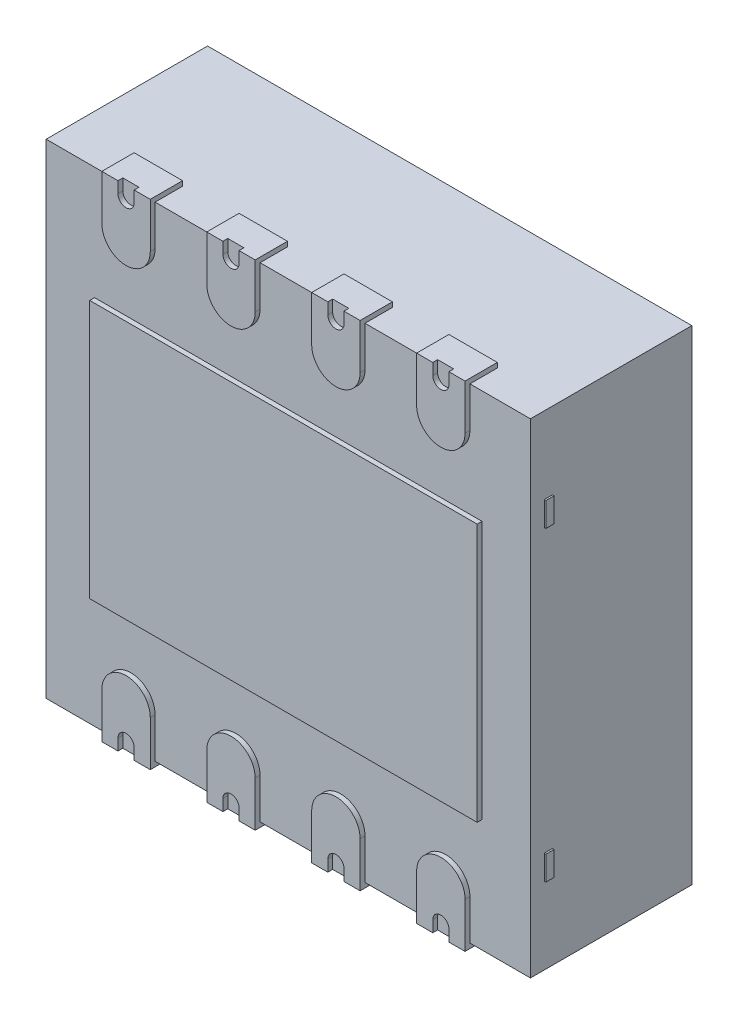
from build123d import *

# Parameters (mm, degrees)
SKETCH1_W            = 3
SKETCH1_H            = 3
BOSS_EXTRUDE1_DEPTH  = 1
SKETCH2_W            = 2.4
SKETCH2_H            = 1.6
BOSS_EXTRUDE2_DEPTH  = 0.03
SKETCH4_W            = 3.940543401
SKETCH4_H            = 3.843561114
SKETCH4_W_2          = 3
SKETCH4_H_2          = 3
CUT_EXTRUDE1_DEPTH   = 60.05
SKETCH7_W            = 0.3
SKETCH7_H            = 0.2
BOSS_EXTRUDE3_DEPTH  = 0.03
CUT_EXTRUDE2_DEPTH   = 0.03
SKETCH9_W            = 0.05
SKETCH9_H            = 0.15
BOSS_EXTRUDE4_DEPTH  = 0.01
BOSS_EXTRUDE9_DEPTH  = 0.01
BOSS_EXTRUDE10_DEPTH = 0.01


with BuildPart() as part:
    # Sketch1 → Boss-Extrude1 (new body)
    with BuildSketch(Plane.XY):
        Rectangle(SKETCH1_W, SKETCH1_H)
    extrude(amount=-BOSS_EXTRUDE1_DEPTH)

    # Sketch2 → Boss-Extrude2 (add)
    with BuildSketch(Plane(origin=(0, 0, 0), x_dir=(-1, 0, 0), z_dir=(0, 0, 1))):
        Rectangle(SKETCH2_W, SKETCH2_H)
        with BuildLine():
            Line((-1.125, 1.25), (-1.125, 1.603517793))
            ThreePointArc((-1.125, 1.603517793), (-0.975, 1.753517793), (-0.825, 1.603517793))
            Line((-0.825, 1.603517793), (-0.825, 1.25))
            ThreePointArc((-0.825, 1.25), (-0.975, 1.1), (-1.125, 1.25))
        make_face()
        with BuildLine():
            Line((-0.175, 1.25), (-0.175, 1.603517793))
            ThreePointArc((-0.175, 1.603517793), (-0.325, 1.753517793), (-0.475, 1.603517793))
            Line((-0.475, 1.603517793), (-0.475, 1.25))
            ThreePointArc((-0.475, 1.25), (-0.325, 1.1), (-0.175, 1.25))
        make_face()
        with BuildLine():
            Line((0.475, 1.25), (0.475, 1.603517793))
            ThreePointArc((0.475, 1.603517793), (0.325, 1.753517793), (0.175, 1.603517793))
            Line((0.175, 1.603517793), (0.175, 1.25))
            ThreePointArc((0.175, 1.25), (0.325, 1.1), (0.475, 1.25))
        make_face()
        with BuildLine():
            Line((1.125, 1.25), (1.125, 1.603517793))
            ThreePointArc((1.125, 1.603517793), (0.975, 1.753517793), (0.825, 1.603517793))
            Line((0.825, 1.603517793), (0.825, 1.25))
            ThreePointArc((0.825, 1.25), (0.975, 1.1), (1.125, 1.25))
        make_face()
        with BuildLine():
            Line((-1.125, -1.25), (-1.125, -1.603517793))
            ThreePointArc((-1.125, -1.603517793), (-0.975, -1.753517793), (-0.825, -1.603517793))
            Line((-0.825, -1.603517793), (-0.825, -1.25))
            ThreePointArc((-0.825, -1.25), (-0.975, -1.1), (-1.125, -1.25))
        make_face()
        with BuildLine():
            Line((-0.475, -1.25), (-0.475, -1.603517793))
            ThreePointArc((-0.475, -1.603517793), (-0.325, -1.753517793), (-0.175, -1.603517793))
            Line((-0.175, -1.603517793), (-0.175, -1.25))
            ThreePointArc((-0.175, -1.25), (-0.325, -1.1), (-0.475, -1.25))
        make_face()
        with BuildLine():
            Line((0.175, -1.25), (0.175, -1.603517793))
            ThreePointArc((0.175, -1.603517793), (0.325, -1.753517793), (0.475, -1.603517793))
            Line((0.475, -1.603517793), (0.475, -1.25))
            ThreePointArc((0.475, -1.25), (0.325, -1.1), (0.175, -1.25))
        make_face()
        with BuildLine():
            Line((0.825, -1.25), (0.825, -1.603517793))
            ThreePointArc((0.825, -1.603517793), (0.975, -1.753517793), (1.125, -1.603517793))
            Line((1.125, -1.603517793), (1.125, -1.25))
            ThreePointArc((1.125, -1.25), (0.975, -1.1), (0.825, -1.25))
        make_face()
    extrude(amount=BOSS_EXTRUDE2_DEPTH)

    # Sketch4 → Cut-Extrude1 (cut)
    with BuildSketch(Plane(origin=(0, 0, -1), x_dir=(-1, 0, 0), z_dir=(0, 0, -1))):
        with Locations((-0.076564963, -0.022969489)):
            Rectangle(SKETCH4_W, SKETCH4_H)
        Rectangle(SKETCH4_W_2, SKETCH4_H_2, mode=Mode.SUBTRACT)
    extrude(amount=-CUT_EXTRUDE1_DEPTH, mode=Mode.SUBTRACT)

    # Sketch7 → Boss-Extrude3 (add)
    with BuildSketch(Plane.XZ.offset(1.5)):
        with Locations((0.975, -0.07)):
            Rectangle(SKETCH7_W, SKETCH7_H)
        with Locations((0.325, -0.07)):
            Rectangle(SKETCH7_W, SKETCH7_H)
        with Locations((-0.325, -0.07)):
            Rectangle(SKETCH7_W, SKETCH7_H)
        with Locations((-0.975, -0.07)):
            Rectangle(SKETCH7_W, SKETCH7_H)
    boss_extrude3 = extrude(amount=BOSS_EXTRUDE3_DEPTH)

    # Mirror1: Boss-Extrude3 across plane
    add(boss_extrude3.mirror(Plane.ZX))

    # Sketch8 → Cut-Extrude2 (cut)
    with BuildSketch(Plane(origin=(0, 0, 0.03), x_dir=(-1, 0, 0), z_dir=(0, 0, 1))):
        with BuildLine():
            Line((-0.925, 1.609812611), (-0.925, 1.459812611))
            ThreePointArc((-0.925, 1.459812611), (-0.975, 1.409812611), (-1.025, 1.459812611))
            Line((-1.025, 1.459812611), (-1.025, 1.609812611))
            ThreePointArc((-1.025, 1.609812611), (-0.975, 1.659812611), (-0.925, 1.609812611))
        make_face()
        with BuildLine():
            Line((-0.375, 1.609812611), (-0.375, 1.459812611))
            ThreePointArc((-0.375, 1.459812611), (-0.325, 1.409812611), (-0.275, 1.459812611))
            Line((-0.275, 1.459812611), (-0.275, 1.609812611))
            ThreePointArc((-0.275, 1.609812611), (-0.325, 1.659812611), (-0.375, 1.609812611))
        make_face()
        with BuildLine():
            Line((0.275, 1.609812611), (0.275, 1.459812611))
            ThreePointArc((0.275, 1.459812611), (0.325, 1.409812611), (0.375, 1.459812611))
            Line((0.375, 1.459812611), (0.375, 1.609812611))
            ThreePointArc((0.375, 1.609812611), (0.325, 1.659812611), (0.275, 1.609812611))
        make_face()
        with BuildLine():
            Line((0.925, 1.609812611), (0.925, 1.459812611))
            ThreePointArc((0.925, 1.459812611), (0.975, 1.409812611), (1.025, 1.459812611))
            Line((1.025, 1.459812611), (1.025, 1.609812611))
            ThreePointArc((1.025, 1.609812611), (0.975, 1.659812611), (0.925, 1.609812611))
        make_face()
        with BuildLine():
            Line((-0.925, -1.609812611), (-0.925, -1.459812611))
            ThreePointArc((-0.925, -1.459812611), (-0.975, -1.409812611), (-1.025, -1.459812611))
            Line((-1.025, -1.459812611), (-1.025, -1.609812611))
            ThreePointArc((-1.025, -1.609812611), (-0.975, -1.659812611), (-0.925, -1.609812611))
        make_face()
        with BuildLine():
            Line((-0.275, -1.609812611), (-0.275, -1.459812611))
            ThreePointArc((-0.275, -1.459812611), (-0.325, -1.409812611), (-0.375, -1.459812611))
            Line((-0.375, -1.459812611), (-0.375, -1.609812611))
            ThreePointArc((-0.375, -1.609812611), (-0.325, -1.659812611), (-0.275, -1.609812611))
        make_face()
        with BuildLine():
            Line((0.375, -1.609812611), (0.375, -1.459812611))
            ThreePointArc((0.375, -1.459812611), (0.325, -1.409812611), (0.275, -1.459812611))
            Line((0.275, -1.459812611), (0.275, -1.609812611))
            ThreePointArc((0.275, -1.609812611), (0.325, -1.659812611), (0.375, -1.609812611))
        make_face()
        with BuildLine():
            Line((1.025, -1.609812611), (1.025, -1.459812611))
            ThreePointArc((1.025, -1.459812611), (0.975, -1.409812611), (0.925, -1.459812611))
            Line((0.925, -1.459812611), (0.925, -1.609812611))
            ThreePointArc((0.925, -1.609812611), (0.975, -1.659812611), (1.025, -1.609812611))
        make_face()
    extrude(amount=-CUT_EXTRUDE2_DEPTH, mode=Mode.SUBTRACT)

    # Sketch9 → Boss-Extrude4 (add)
    with BuildSketch(Plane.ZY.offset(1.5)):
        with Locations((-0.110800284, 0.948643646)):
            Rectangle(SKETCH9_W, SKETCH9_H)
        with Locations((-0.110800284, -0.948643646)):
            Rectangle(SKETCH9_W, SKETCH9_H)
    boss_extrude4 = extrude(amount=BOSS_EXTRUDE4_DEPTH)

    # Mirror2: Boss-Extrude4 across plane
    add(boss_extrude4.mirror(Plane(origin=(0, 0, 0), x_dir=(0, 0, 1), z_dir=(1, 0, 0))))

    # Sketch11 → Boss-Extrude9 (add)
    # profile 1 of 2: a face of its own
    with BuildSketch(Plane(origin=(0, 0, -1), x_dir=(-1, 0, 0), z_dir=(0, 0, -1))):
        with BuildLine():
            Line((-0.805854291, 1.038109942), (-0.423255467, 0.605441833))
            Line((-0.423255467, 0.605441833), (-0.423255467, 1.038109942))
            Line((-0.423255467, 1.038109942), (-0.097177649, 1.038109942))
            Line((-0.097177649, 1.038109942), (0.052640904, 0.796577554))
            Line((0.052640904, 0.796577554), (0.201820168, 1.038109942))
            Line((0.201820168, 1.038109942), (0.943650762, 1.038109942))
            ThreePointArc((0.943650762, 1.038109942), (1.045474138, 0.995933319), (1.087650762, 0.894109942))
            Line((1.087650762, 0.894109942), (1.087650762, 0.670379201))
            ThreePointArc((1.087650762, 0.670379201), (1.045474138, 0.568555824), (0.943650762, 0.526379201))
            Line((0.943650762, 0.526379201), (0.543475021, 0.526379201))
            Line((0.543475021, 0.526379201), (0.543475021, 0.206356726))
            Line((0.543475021, 0.206356726), (0.201820168, 0.206356726))
            Line((0.201820168, 0.206356726), (0.052640904, 0.446858476))
            Line((0.052640904, 0.446858476), (-0.093279754, 0.210602016))
            Line((-0.093279754, 0.210602016), (-0.396062037, 0.210602016))
            Line((-0.396062037, 0.210602016), (-0.788189355, 0.654045576))
            Line((-0.788189355, 0.654045576), (-0.788189355, 0.214790298))
            Line((-0.788189355, 0.214790298), (-1.067573051, 0.214790298))
            Line((-1.067573051, 0.214790298), (-1.067573051, 1.038109942))
            Line((-1.067573051, 1.038109942), (-0.805854291, 1.038109942))
        make_face()
        Polygon((-0.362302815, 0.999733668), (-0.118839535, 0.999733668), (0.05523679, 0.721091876), (0.222284334, 0.999733668), (0.465308002, 0.999733668), (0.23905049, 0.622327348), (0.473025575, 0.247806363), (0.231595523, 0.247806363), (0.05523679, 0.530101575), (-0.112552144, 0.250223114), (-0.362302815, 0.250223114), (-0.125560237, 0.626220348), align=None, mode=Mode.SUBTRACT)
        with BuildLine():
            Line((0.51730694, 0.999733668), (0.910767238, 0.994219094))
            ThreePointArc((0.910767238, 0.994219094), (1.011989543, 0.950619639), (1.052735051, 0.84821519))
            Line((1.052735051, 0.84821519), (1.050676437, 0.701334767))
            ThreePointArc((1.050676437, 0.701334767), (1.007797951, 0.600818431), (0.906690578, 0.559352812))
            Line((0.906690578, 0.559352812), (0.501176929, 0.559352812))
            Line((0.501176929, 0.559352812), (0.501176929, 0.269954806))
            Line((0.501176929, 0.269954806), (0.288716116, 0.622327348))
            Line((0.288716116, 0.622327348), (0.51730694, 0.999733668))
        make_face(mode=Mode.SUBTRACT)
        Polygon((-1.028178054, 0.254481122), (-1.028178054, 0.991192026), (-0.812896495, 0.991192026), (-0.374426195, 0.481817999), (-0.374426195, 0.939702526), (-0.178785, 0.626220348), (-0.398074818, 0.261293182), (-0.82547709, 0.757809403), (-0.82547709, 0.254481122), align=None, mode=Mode.SUBTRACT)
    # profile 2 of 2: a face of its own
    with BuildSketch(Plane(origin=(0, 0, -1), x_dir=(-1, 0, 0), z_dir=(0, 0, -1))):
        with BuildLine():
            Line((0.501176929, 0.890202885), (0.501176929, 0.670379201))
            Line((0.501176929, 0.670379201), (0.874246648, 0.670379201))
            ThreePointArc((0.874246648, 0.670379201), (0.908187774, 0.684438075), (0.922246648, 0.718379201))
            Line((0.922246648, 0.718379201), (0.922246648, 0.842202885))
            ThreePointArc((0.922246648, 0.842202885), (0.908187774, 0.876144011), (0.874246648, 0.890202885))
            Line((0.874246648, 0.890202885), (0.501176929, 0.890202885))
        make_face()
        with BuildLine():
            Line((0.539738286, 0.850364718), (0.829407549, 0.850364718))
            ThreePointArc((0.829407549, 0.850364718), (0.863348674, 0.836305844), (0.877407549, 0.802364718))
            Line((0.877407549, 0.802364718), (0.877407549, 0.760827608))
            ThreePointArc((0.877407549, 0.760827608), (0.863348674, 0.726886482), (0.829407549, 0.712827608))
            Line((0.829407549, 0.712827608), (0.539738286, 0.712827608))
            Line((0.539738286, 0.712827608), (0.539738286, 0.850364718))
        make_face(mode=Mode.SUBTRACT)
    extrude(amount=BOSS_EXTRUDE9_DEPTH)

    # Sketch12 → Boss-Extrude10 (add)
    # profile 1 of 7: a face of its own
    with BuildSketch(Plane(origin=(0, 0, -1), x_dir=(-1, 0, 0), z_dir=(0, 0, -1))):
        Polygon((-1.037035456, -0.548636153), (-0.821650841, -0.548636153), (-0.821650841, -0.620431025), (-0.893445713, -0.620431025), (-0.893445713, -0.948636153), (-0.965240585, -0.948636153), (-0.965240585, -0.620431025), (-1.037035456, -0.620431025), align=None)
    # profile 2 of 7: a face of its own
    with BuildSketch(Plane(origin=(0, 0, -1), x_dir=(-1, 0, 0), z_dir=(0, 0, -1))):
        with BuildLine():
            Line((-0.662676482, -0.548636153), (-0.59088161, -0.548636153))
            Line((-0.59088161, -0.548636153), (-0.59088161, -0.814181025))
            add(Edge.make_bspline(
                [(-0.59088161, -0.814181025), (-0.590907932, -0.819256306), (-0.59095865, -0.82903537), (-0.591466423, -0.843113611), (-0.592153022, -0.856021258), (-0.59314179, -0.867737628), (-0.594610382, -0.878262153), (-0.596272382, -0.887621092), (-0.59810603, -0.895852581), (-0.60120351, -0.905064896), (-0.606012259, -0.915266488), (-0.613268798, -0.926285657), (-0.622305512, -0.935859438), (-0.632712821, -0.944175372), (-0.644578415, -0.950760019), (-0.657628938, -0.95551942), (-0.671822672, -0.958362719), (-0.681653617, -0.958712489), (-0.686714944, -0.958892564)],
                knots=[0, 0, 0, 0, 1.22248561, 2.355488409, 3.392943897, 4.335991845, 5.186735882, 5.951517034, 6.625683685, 7.215700098, 8.28923535, 9.333114649, 10.380102123, 11.447198135, 12.530158036, 13.633358744, 14.781567393, 16, 16, 16, 16], degree=3))
            add(Edge.make_bspline(
                [(-0.686714944, -0.958892564), (-0.691988385, -0.958729304), (-0.702389672, -0.958407292), (-0.717644229, -0.955664578), (-0.732305766, -0.951267182), (-0.746298431, -0.944909075), (-0.759813927, -0.936944688), (-0.772606962, -0.92706564), (-0.784944636, -0.915578324), (-0.792258484, -0.906763247), (-0.796009815, -0.902241923)],
                knots=[0, 0, 0, 0, 0.990984786, 1.954608977, 2.90473533, 3.862451285, 4.837525908, 5.848096122, 6.896271184, 8, 8, 8, 8], degree=3))
            Line((-0.796009815, -0.902241923), (-0.741682892, -0.852001538))
            add(Edge.make_bspline(
                [(-0.741682892, -0.852001538), (-0.738838396, -0.85521786), (-0.733515579, -0.861236464), (-0.72549425, -0.86908487), (-0.718258579, -0.875390159), (-0.711437736, -0.87993822), (-0.70500107, -0.883144096), (-0.698810093, -0.885453379), (-0.692671821, -0.886760564), (-0.688616691, -0.886987017), (-0.686634815, -0.887097692)],
                knots=[0, 0, 0, 0, 1.529509877, 2.862124173, 3.996688592, 4.944357383, 5.774364335, 6.554177287, 7.293378699, 8, 8, 8, 8], degree=3))
            add(Edge.make_bspline(
                [(-0.686634815, -0.887097692), (-0.68471658, -0.886997659), (-0.681028445, -0.886805329), (-0.675957117, -0.884667333), (-0.671681662, -0.881310591), (-0.668866954, -0.87745158), (-0.66707324, -0.873506631), (-0.665952494, -0.869693232), (-0.664888904, -0.865122), (-0.66403678, -0.859795227), (-0.663392913, -0.853643431), (-0.663071992, -0.846741295), (-0.66268171, -0.839051521), (-0.662678287, -0.833679547), (-0.662676482, -0.830847692)],
                knots=[0, 0, 0, 0, 1.003927327, 1.930222208, 2.840933547, 3.835773585, 4.407906147, 5.114514582, 5.922289074, 6.876303333, 7.950072246, 9.174518422, 10.510537432, 12, 12, 12, 12], degree=3))
            Line((-0.662676482, -0.830847692), (-0.662676482, -0.548636153))
        make_face()
    # profile 3 of 7: a face of its own
    with BuildSketch(Plane(origin=(0, 0, -1), x_dir=(-1, 0, 0), z_dir=(0, 0, -1))):
        Polygon((-0.375416867, -0.548636153), (-0.308830328, -0.548636153), (-0.147291867, -0.948636153), (-0.223974559, -0.948636153), (-0.255064303, -0.866584871), (-0.429343149, -0.866584871), (-0.460432892, -0.948636153), (-0.537035456, -0.948636153), align=None)
        Polygon((-0.342163662, -0.65592782), (-0.402099559, -0.79479), (-0.282227764, -0.79479), align=None, mode=Mode.SUBTRACT)
    # profile 4 of 7: a face of its own
    with BuildSketch(Plane(origin=(0, 0, -1), x_dir=(-1, 0, 0), z_dir=(0, 0, -1))):
        Polygon((-0.045448918, -0.548636153), (0.065528646, -0.548636153), (0.065528646, -0.948636153), (-0.006266226, -0.948636153), (-0.006266226, -0.61530282), (-0.088317508, -0.61530282), align=None)
    # profile 5 of 7: a face of its own
    with BuildSketch(Plane(origin=(0, 0, -1), x_dir=(-1, 0, 0), z_dir=(0, 0, -1))):
        Polygon((0.349663261, -0.538379743), (0.424503005, -0.538379743), (0.424503005, -0.799918205), (0.460400441, -0.799918205), (0.460400441, -0.866584871), (0.424503005, -0.866584871), (0.424503005, -0.948636153), (0.352708133, -0.948636153), (0.352708133, -0.866584871), (0.183477364, -0.866584871), (0.183477364, -0.793908589), align=None)
        Polygon((0.352708133, -0.799918205), (0.352708133, -0.663780384), (0.264166467, -0.799918205), align=None, mode=Mode.SUBTRACT)
    # profile 6 of 7: a face of its own
    with BuildSketch(Plane(origin=(0, 0, -1), x_dir=(-1, 0, 0), z_dir=(0, 0, -1))):
        Polygon((0.657355569, -0.538379743), (0.732195313, -0.538379743), (0.732195313, -0.799918205), (0.768092749, -0.799918205), (0.768092749, -0.866584871), (0.732195313, -0.866584871), (0.732195313, -0.948636153), (0.660400441, -0.948636153), (0.660400441, -0.866584871), (0.491169672, -0.866584871), (0.491169672, -0.793908589), align=None)
        Polygon((0.660400441, -0.799918205), (0.660400441, -0.663780384), (0.571858774, -0.799918205), align=None, mode=Mode.SUBTRACT)
    # profile 7 of 7: a face of its own
    with BuildSketch(Plane(origin=(0, 0, -1), x_dir=(-1, 0, 0), z_dir=(0, 0, -1))):
        with BuildLine():
            add(Edge.make_bspline(
                [(1.020977364, -0.733251538), (1.025171868, -0.736248624), (1.03347451, -0.742181086), (1.044439263, -0.752809314), (1.053883737, -0.764665225), (1.061708757, -0.777676097), (1.067977927, -0.791522121), (1.072465701, -0.806055298), (1.075316284, -0.821147443), (1.075627652, -0.831422597), (1.075785056, -0.836616923)],
                knots=[0, 0, 0, 0, 1.013736912, 2.006600758, 2.994453809, 3.989973287, 4.987781207, 5.978959008, 6.978317308, 8, 8, 8, 8], degree=3))
            add(Edge.make_bspline(
                [(1.075785056, -0.836616923), (1.07559516, -0.842241464), (1.075218526, -0.853397019), (1.071888575, -0.869756639), (1.066542472, -0.885473515), (1.05923598, -0.900374174), (1.050074982, -0.91399556), (1.039396986, -0.926054368), (1.027188533, -0.936235661), (1.015822118, -0.943143604), (1.006038647, -0.947732419), (0.998143472, -0.950669169), (0.989806686, -0.953254566), (0.980968799, -0.955320127), (0.971631418, -0.956932636), (0.961807869, -0.957997534), (0.951491685, -0.95877165), (0.944456484, -0.95885158), (0.940849159, -0.958892564)],
                knots=[0, 0, 0, 0, 1.313679292, 2.605514271, 3.884962679, 5.186178731, 6.472827995, 7.711026938, 8.938935107, 10.174644318, 10.808706728, 11.462743532, 12.142127587, 12.847854939, 13.582806024, 14.355735269, 15.156897313, 16, 16, 16, 16], degree=3))
            add(Edge.make_bspline(
                [(0.940849159, -0.958892564), (0.937002305, -0.958840383), (0.929490157, -0.958738484), (0.918524095, -0.958122348), (0.908179858, -0.956986433), (0.898435749, -0.955491089), (0.889301142, -0.953512315), (0.880775766, -0.951003339), (0.872839036, -0.94814659), (0.863124062, -0.943796944), (0.852021608, -0.937004041), (0.840021863, -0.92705603), (0.829489157, -0.915207639), (0.820331967, -0.901791449), (0.813113925, -0.886889997), (0.807746373, -0.870970992), (0.804567646, -0.854077571), (0.804184963, -0.842506408), (0.803990185, -0.836616923)],
                knots=[0, 0, 0, 0, 0.886964665, 1.7320671, 2.531131818, 3.285397207, 4.004107883, 4.684213108, 5.332925796, 5.947568694, 7.135706876, 8.320776993, 9.52873045, 10.778999824, 12.05415135, 13.333578234, 14.642845846, 16, 16, 16, 16], degree=3))
            add(Edge.make_bspline(
                [(0.803990185, -0.836616923), (0.804168179, -0.831479316), (0.80451796, -0.821383296), (0.807023485, -0.806589434), (0.8113197, -0.792563102), (0.817214775, -0.779206655), (0.824816374, -0.766518607), (0.834169449, -0.754592317), (0.845155412, -0.743320192), (0.853486273, -0.736663426), (0.85775621, -0.733251538)],
                knots=[0, 0, 0, 0, 1.01821053, 2.000906977, 2.963938143, 3.919209931, 4.888045165, 5.887808425, 6.917407893, 8, 8, 8, 8], degree=3))
            add(Edge.make_bspline(
                [(0.85775621, -0.733251538), (0.855109076, -0.730198456), (0.849897666, -0.724187857), (0.84315405, -0.714514276), (0.837472837, -0.704540805), (0.832649217, -0.694348382), (0.829083474, -0.68376152), (0.82638695, -0.672946666), (0.824861799, -0.661793641), (0.824623414, -0.654276171), (0.824503005, -0.650479102)],
                knots=[0, 0, 0, 0, 1.061529281, 2.089831458, 3.092927091, 4.075998741, 5.048384512, 6.024008542, 7.00192825, 8, 8, 8, 8], degree=3))
            add(Edge.make_bspline(
                [(0.824503005, -0.650479102), (0.824662648, -0.645338991), (0.824977618, -0.63519775), (0.82776729, -0.620368861), (0.832398822, -0.60627846), (0.838699627, -0.592967804), (0.84670067, -0.580726982), (0.856207641, -0.569749701), (0.86735419, -0.560438055), (0.879725807, -0.552448252), (0.893384503, -0.546093236), (0.908200687, -0.541646472), (0.923995451, -0.538831436), (0.93488073, -0.538532598), (0.940448518, -0.538379743)],
                knots=[0, 0, 0, 0, 1.022455555, 2.017265428, 2.990720743, 3.968117071, 4.939886797, 5.893155559, 6.847550415, 7.820889576, 8.817530429, 9.83499769, 10.892607882, 12, 12, 12, 12], degree=3))
            add(Edge.make_bspline(
                [(0.940448518, -0.538379743), (0.945936115, -0.538532848), (0.95663578, -0.538831371), (0.972152971, -0.541627754), (0.986648975, -0.546173571), (1.000003918, -0.552662769), (1.012247588, -0.560667972), (1.023204693, -0.570303841), (1.032681831, -0.581554529), (1.040749288, -0.594112017), (1.047177811, -0.607640891), (1.051930396, -0.621828724), (1.054679347, -0.636563998), (1.055073816, -0.646568554), (1.055272236, -0.651600897)],
                knots=[0, 0, 0, 0, 1.094655142, 2.134348324, 3.136019022, 4.118575226, 5.088726318, 6.048298823, 7.020513804, 8.015920439, 9.020015034, 10.003048569, 10.995523219, 12, 12, 12, 12], degree=3))
            add(Edge.make_bspline(
                [(1.055272236, -0.651600897), (1.055176652, -0.655157485), (1.054989077, -0.662137022), (1.05360218, -0.672419851), (1.051266816, -0.682286239), (1.04801079, -0.691974616), (1.043483802, -0.70174827), (1.037357735, -0.711794481), (1.029906179, -0.722530671), (1.024054099, -0.729557289), (1.020977364, -0.733251538)],
                knots=[0, 0, 0, 0, 0.940746401, 1.846144481, 2.739104268, 3.619506754, 4.545839139, 5.581956076, 6.728711598, 8, 8, 8, 8], degree=3))
        make_face()
        with BuildLine():
            add(Edge.make_bspline(
                [(0.938685697, -0.610174615), (0.935729753, -0.610317119), (0.929979787, -0.61059432), (0.921775259, -0.613096372), (0.914399121, -0.617188654), (0.908019747, -0.62282044), (0.902788328, -0.629653769), (0.898943523, -0.637510076), (0.896663508, -0.646292408), (0.896422124, -0.652441962), (0.896297877, -0.655607307)],
                knots=[0, 0, 0, 0, 1.018099191, 1.980427864, 2.929421084, 3.909248076, 4.895556904, 5.880788387, 6.909183412, 8, 8, 8, 8], degree=3))
            add(Edge.make_bspline(
                [(0.896297877, -0.655607307), (0.89645136, -0.658799685), (0.89675105, -0.665033111), (0.899107778, -0.673984179), (0.903124885, -0.682096392), (0.908640347, -0.689200313), (0.915342526, -0.69500259), (0.922846911, -0.699434047), (0.931236729, -0.70196385), (0.937066847, -0.7023069), (0.940047877, -0.702482307)],
                knots=[0, 0, 0, 0, 1.07118507, 2.091592095, 3.082435519, 4.092579768, 5.090825648, 6.043203473, 6.999459622, 8, 8, 8, 8], degree=3))
            add(Edge.make_bspline(
                [(0.940047877, -0.702482307), (0.943085265, -0.702346397), (0.949002665, -0.702081618), (0.957413431, -0.699486173), (0.964990457, -0.695335288), (0.971479059, -0.689466855), (0.976853615, -0.682360362), (0.980767781, -0.67410638), (0.983020633, -0.664859993), (0.983321396, -0.658397617), (0.983477364, -0.65504641)],
                knots=[0, 0, 0, 0, 1.008803858, 1.965339183, 2.900766489, 3.864508618, 4.855158575, 5.849593072, 6.884859315, 8, 8, 8, 8], degree=3))
            add(Edge.make_bspline(
                [(0.983477364, -0.65504641), (0.983317451, -0.651883157), (0.983008185, -0.645765538), (0.980790629, -0.636982637), (0.976717976, -0.629248948), (0.971367036, -0.622458052), (0.964658392, -0.616981618), (0.956870147, -0.612954215), (0.94805965, -0.610618282), (0.941878013, -0.610325707), (0.938685697, -0.610174615)],
                knots=[0, 0, 0, 0, 1.065910571, 2.061433587, 3.023559535, 3.990682701, 4.956464619, 5.918590567, 6.925120432, 8, 8, 8, 8], degree=3))
        make_face(mode=Mode.SUBTRACT)
        with BuildLine():
            add(Edge.make_bspline(
                [(0.941009415, -0.774277179), (0.938763121, -0.774314482), (0.934335703, -0.774388006), (0.927827035, -0.775235847), (0.921581299, -0.776499339), (0.915606244, -0.77824229), (0.909932055, -0.780618372), (0.904510635, -0.783482782), (0.899360706, -0.786864477), (0.894558657, -0.790702061), (0.890218727, -0.794914175), (0.886306674, -0.799307274), (0.883109123, -0.803994931), (0.880446326, -0.808821326), (0.878306753, -0.813824706), (0.876892334, -0.819087467), (0.875981646, -0.824539524), (0.875850972, -0.828253244), (0.875785056, -0.830126538)],
                knots=[0, 0, 0, 0, 1.129580664, 2.226389355, 3.296443603, 4.333934503, 5.352185725, 6.386189251, 7.41493955, 8.447544828, 9.47401038, 10.455044306, 11.4018853, 12.322125673, 13.225630306, 14.132028716, 15.057747923, 16, 16, 16, 16], degree=3))
            add(Edge.make_bspline(
                [(0.875785056, -0.830126538), (0.875816473, -0.832080199), (0.875878783, -0.835955044), (0.876819898, -0.841610694), (0.878174937, -0.847065179), (0.880078132, -0.852267443), (0.882623294, -0.857214458), (0.885662264, -0.861954318), (0.889301009, -0.866453787), (0.893440866, -0.87068874), (0.898075417, -0.874509424), (0.903070448, -0.877875513), (0.908359985, -0.880843229), (0.914102817, -0.882980696), (0.920086263, -0.884937094), (0.926470622, -0.886123993), (0.933186163, -0.886997347), (0.9377744, -0.88706367), (0.940128005, -0.887097692)],
                knots=[0, 0, 0, 0, 0.973817353, 1.931446211, 2.852767904, 3.776304432, 4.688323523, 5.623710549, 6.581246645, 7.570897993, 8.57436511, 9.572506873, 10.574556662, 11.591826551, 12.624694332, 13.712108235, 14.826391851, 16, 16, 16, 16], degree=3))
            add(Edge.make_bspline(
                [(0.940128005, -0.887097692), (0.942507149, -0.887054567), (0.947143348, -0.886970531), (0.953920538, -0.886227806), (0.960330558, -0.885049319), (0.966365749, -0.883363807), (0.972048936, -0.881204599), (0.977303882, -0.878456355), (0.982250566, -0.87534183), (0.986730028, -0.871703133), (0.990820106, -0.867737712), (0.994344283, -0.863391949), (0.997340851, -0.858805586), (0.99975791, -0.853929069), (1.001708259, -0.848785416), (1.003046077, -0.84332334), (1.003876241, -0.837604222), (1.003951795, -0.833708501), (1.003990185, -0.831729102)],
                knots=[0, 0, 0, 0, 1.200705402, 2.339794563, 3.437264955, 4.487414319, 5.499029866, 6.500076882, 7.476298407, 8.444948224, 9.407950986, 10.347155707, 11.263432813, 12.167927724, 13.089546445, 14.03463663, 15.00140776, 16, 16, 16, 16], degree=3))
            add(Edge.make_bspline(
                [(1.003990185, -0.831729102), (1.003916884, -0.829723826), (1.003773607, -0.825804206), (1.002989616, -0.820015965), (1.001518928, -0.814528623), (0.99959484, -0.809214913), (0.99703536, -0.804184794), (0.993857821, -0.799448883), (0.990241002, -0.794889864), (0.98601374, -0.790710689), (0.981391886, -0.786889438), (0.976472659, -0.783485123), (0.971271211, -0.780601982), (0.965773314, -0.778245158), (0.95995888, -0.776498432), (0.953872274, -0.775235891), (0.94752348, -0.774387816), (0.943202369, -0.774314425), (0.941009415, -0.774277179)],
                knots=[0, 0, 0, 0, 1.011708178, 1.977538892, 2.938094892, 3.871441737, 4.823268678, 5.775953079, 6.743660653, 7.753304209, 8.767430709, 9.76505158, 10.765940967, 11.761741361, 12.775867861, 13.822051386, 14.89469657, 16, 16, 16, 16], degree=3))
        make_face(mode=Mode.SUBTRACT)
    extrude(amount=BOSS_EXTRUDE10_DEPTH)


solid = part.part
